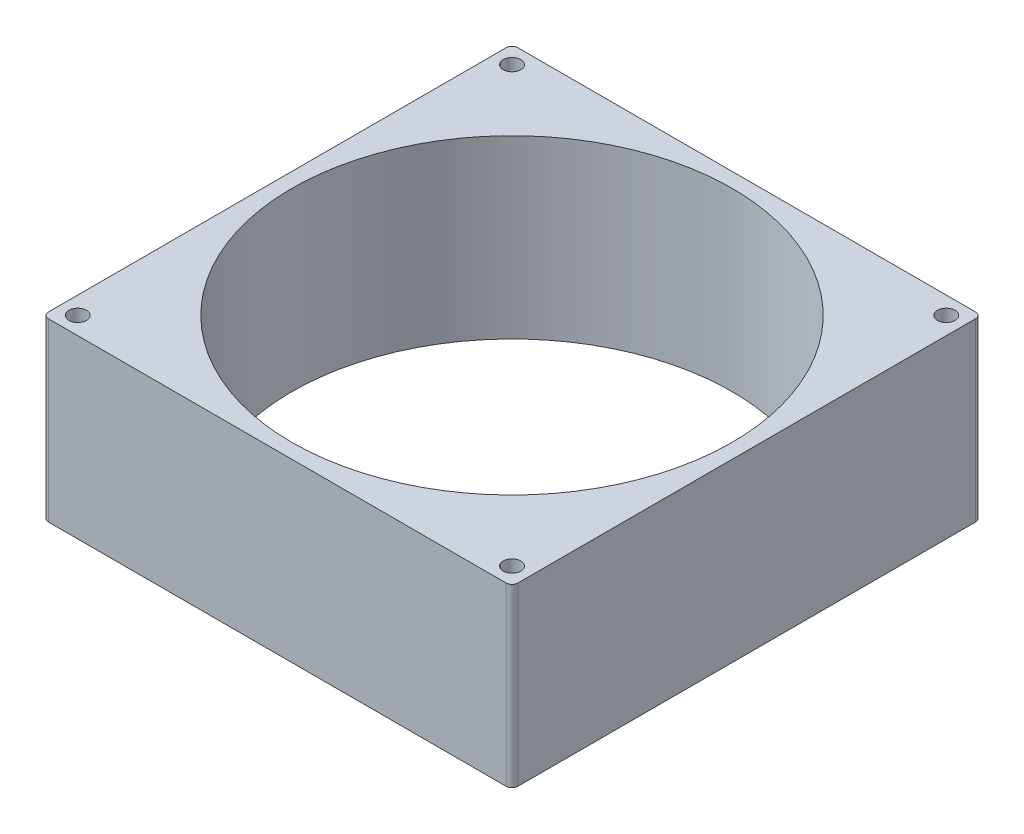
from build123d import *

# Parameters (mm, degrees)
SKETCH1_W           = 80
SKETCH1_H           = 80
SKETCH1_R           = 37.5
SKETCH1_R_2         = 1.5
BOSS_EXTRUDE1_DEPTH = 30
FILLET1_R           = 1


with BuildPart() as part:
    # Sketch1 → Boss-Extrude1 (new body)
    with BuildSketch(Plane(origin=(0, 0, 0), x_dir=(1, 0, 0), z_dir=(0, 1, 0))):
        Rectangle(SKETCH1_W, SKETCH1_H)
        with Locations(Location((0, 0, 0), (0, 0, 270))):
            Circle(SKETCH1_R, mode=Mode.SUBTRACT)
        with Locations(Location((-37, 37, 0), (0, 0, 270))):
            Circle(SKETCH1_R_2, mode=Mode.SUBTRACT)
        with Locations(Location((37, 37, 0), (0, 0, 270))):
            Circle(SKETCH1_R_2, mode=Mode.SUBTRACT)
        with Locations(Location((37, -37, 0), (0, 0, 270))):
            Circle(SKETCH1_R_2, mode=Mode.SUBTRACT)
        with Locations(Location((-37, -37, 0), (0, 0, 270))):
            Circle(SKETCH1_R_2, mode=Mode.SUBTRACT)
    extrude(amount=BOSS_EXTRUDE1_DEPTH)

    # Fillet1
    fillet1_edges = [part.edges().sort_by_distance(p)[0] for p in [
        (40, 15, 40),
        (-40, 15, 40),
        (-40, 15, -40),
        (40, 15, -40),
    ]]
    fillet(fillet1_edges, radius=FILLET1_R)


solid = part.part
